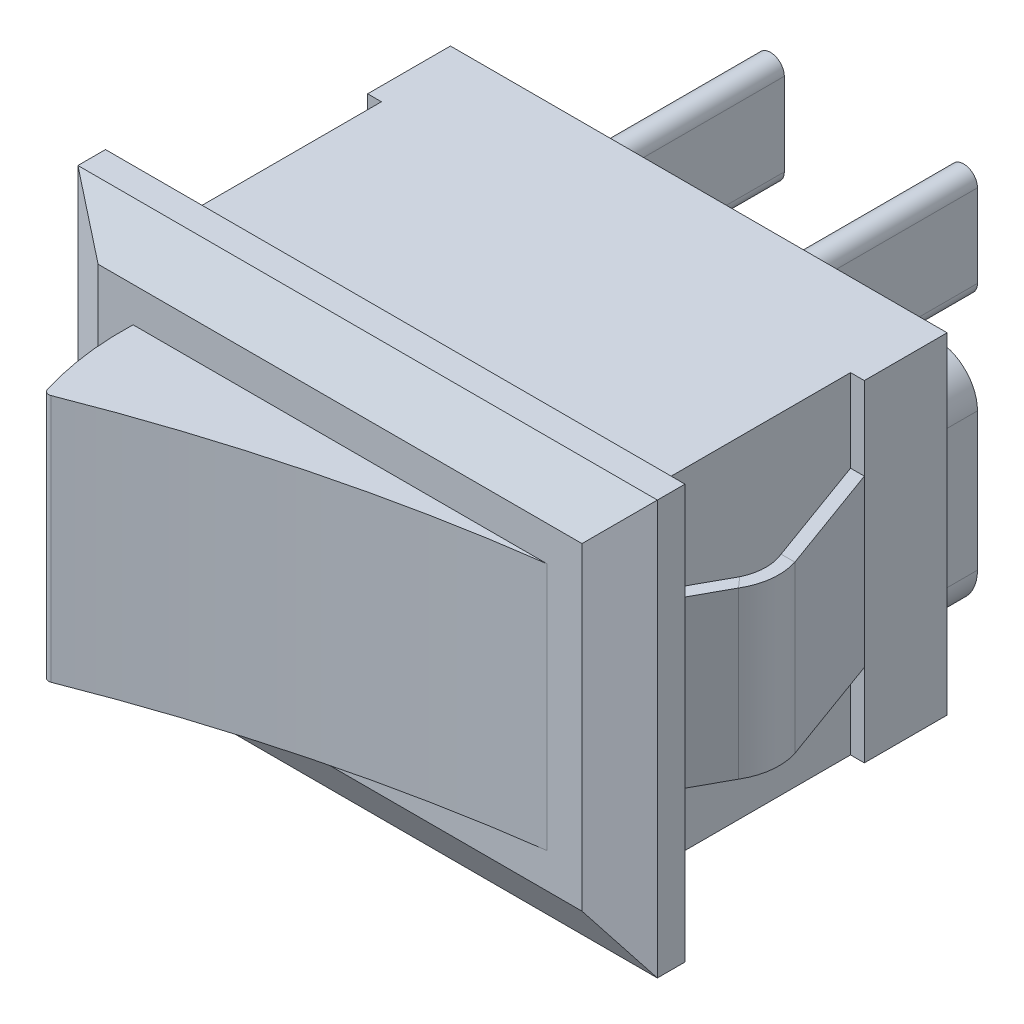
from build123d import *
from OCP.BRepFilletAPI import BRepFilletAPI_MakeChamfer

# Parameters (mm, degrees)
SKETCH_1_W             = 21
SKETCH_1_H             = 15
EXTRUDE_1_DEPTH        = 17
SKETCH_3_OUTSIDE_W     = 29.18
SKETCH_3_OUTSIDE_H     = 23.18
SKETCH_3_OUTSIDE_W_2   = 18
SKETCH_3_OUTSIDE_H_2   = 12
CUT_EXTRUDE_1_DEPTH    = 11
SKETCH_4_OUTSIDE_W     = 29.18
SKETCH_4_OUTSIDE_H     = 23.18
SKETCH_4_OUTSIDE_W_2   = 15
SKETCH_4_OUTSIDE_H_2   = 9
CUT_EXTRUDE_2_DEPTH    = 4
CUT_EXTRUDE_3_REACH    = 31.563
CUT_EXTRUDE_4_REACH    = 31.563
FILLET_2_R             = 0.2
CHAMFER_1_SIZE         = 1
CHAMFER_1_SIZE2        = 1.732050808
CUT_EXTRUDE_5_REACH    = 32.046
SKETCH_7_W             = 3.215432019
SKETCH_7_H             = 8
SKETCH_8_W             = 0.5
SKETCH_8_H             = 6
EXTRUDE_2_DEPTH        = 1.6
EXTRUDE_3_DEPTH        = 8
PATTERN_LINEAR_2_COUNT = 3
PATTERN_LINEAR_2_PITCH = 7
PATTERN_LINEAR_3_COUNT = 2
PATTERN_LINEAR_3_PITCH = 7


with BuildPart() as part:
    # 草图1 → 凸台-拉伸1 (new body)
    with BuildSketch(Plane.XY):
        with Locations((10.5, 7.5)):
            Rectangle(SKETCH_1_W, SKETCH_1_H)
    extrude(amount=EXTRUDE_1_DEPTH)

    # 草图3 outside → 切除-拉伸1 (cut)
    with BuildSketch(Plane(origin=(0, 0, 0), x_dir=(-1, 0, 0), z_dir=(0, 0, -1))):
        with Locations((-10.5, 7.5)):
            Rectangle(SKETCH_3_OUTSIDE_W, SKETCH_3_OUTSIDE_H)
        with Locations((-10.5, 7.5)):
            Rectangle(SKETCH_3_OUTSIDE_W_2, SKETCH_3_OUTSIDE_H_2, mode=Mode.SUBTRACT)
    extrude(amount=-CUT_EXTRUDE_1_DEPTH, mode=Mode.SUBTRACT)

    # 草图4 outside → 切除-拉伸2 (cut)
    with BuildSketch(Plane.XY.offset(17)):
        with Locations((10.5, 7.5)):
            Rectangle(SKETCH_4_OUTSIDE_W, SKETCH_4_OUTSIDE_H)
        with Locations((10.5, 7.5)):
            Rectangle(SKETCH_4_OUTSIDE_W_2, SKETCH_4_OUTSIDE_H_2, mode=Mode.SUBTRACT)
    extrude(amount=-CUT_EXTRUDE_2_DEPTH, mode=Mode.SUBTRACT)

    # 草图5 → 切除-拉伸3 (cut, up to next)
    with BuildSketch(Plane.XZ.offset(-3), mode=Mode.PRIVATE) as cut_extrude_3_sk1:
        with BuildLine():
            Line((3, 17), (3.786081295, 18.926671419))
            Line((3.786081295, 18.926671419), (19.848042348, 18.643435221))
            Line((19.848042348, 18.643435221), (18, 13))
            ThreePointArc((18, 13), (10.37304874, 14.523932773), (3, 17))
        make_face()
    cut_extrude_3_tool1 = extrude(cut_extrude_3_sk1.sketch, amount=-CUT_EXTRUDE_3_REACH, mode=Mode.PRIVATE) & part.part
    add(cut_extrude_3_tool1.solids().sort_by_distance((12.266887, 3, 16.568518))[0], mode=Mode.SUBTRACT)

    # 草图6 → 切除-拉伸4 (cut, up to next)
    with BuildSketch(Plane.XZ.offset(-3), mode=Mode.PRIVATE) as cut_extrude_4_sk1:
        with BuildLine():
            Line((3.538726555, 16.783166359), (1.834472807, 18.259535343))
            Line((1.834472807, 18.259535343), (1.834472807, 13.545763946))
            Line((1.834472807, 13.545763946), (3, 13))
            ThreePointArc((3, 13), (3.102200266, 14.915387354), (3.538726555, 16.783166359))
        make_face()
    cut_extrude_4_tool1 = extrude(cut_extrude_4_sk1.sketch, amount=-CUT_EXTRUDE_4_REACH, mode=Mode.PRIVATE) & part.part
    add(cut_extrude_4_tool1.solids().sort_by_distance((2.498394, 3, 15.595743))[0], mode=Mode.SUBTRACT)

    # 圆角2
    fillet_2_edges = [part.edges().sort_by_distance(p)[0] for p in [
        (3.538726555, 7.5, 16.783166359),
    ]]
    fillet(fillet_2_edges, radius=FILLET_2_R)

    # 倒角1: one chamfer whose edges measure the first distance from different faces: ONE call of the kernel's chamfer builder (chamfer() names one face for all edges)
    chamfer_1_edges_1 = [part.edges().sort_by_distance(p)[0] for p in [
        (10.5, 15, 13),
    ]]
    chamfer_1_side_1 = [part.faces().sort_by_distance(p)[0] for p in [
        (10.5, 15, 12),
    ]]
    chamfer_1_edges_2 = [part.edges().sort_by_distance(p)[0] for p in [
        (0, 7.5, 13),
    ]]
    chamfer_1_side_2 = [part.faces().sort_by_distance(p)[0] for p in [
        (0, 7.5, 12),
    ]]
    chamfer_1_edges_3 = [part.edges().sort_by_distance(p)[0] for p in [
        (10.5, 0, 13),
    ]]
    chamfer_1_side_3 = [part.faces().sort_by_distance(p)[0] for p in [
        (10.5, 0, 12),
    ]]
    chamfer_1_edges_4 = [part.edges().sort_by_distance(p)[0] for p in [
        (21, 7.5, 13),
    ]]
    chamfer_1_side_4 = [part.faces().sort_by_distance(p)[0] for p in [
        (21, 7.5, 12),
    ]]
    chamfer_1 = BRepFilletAPI_MakeChamfer(part.part.solid().wrapped)
    for e in chamfer_1_edges_1:
        chamfer_1.Add(CHAMFER_1_SIZE, CHAMFER_1_SIZE2, e.wrapped, chamfer_1_side_1[0].wrapped)  # the first distance lies on this face
    for e in chamfer_1_edges_2:
        chamfer_1.Add(CHAMFER_1_SIZE, CHAMFER_1_SIZE2, e.wrapped, chamfer_1_side_2[0].wrapped)  # the first distance lies on this face
    for e in chamfer_1_edges_3:
        chamfer_1.Add(CHAMFER_1_SIZE, CHAMFER_1_SIZE2, e.wrapped, chamfer_1_side_3[0].wrapped)  # the first distance lies on this face
    for e in chamfer_1_edges_4:
        chamfer_1.Add(CHAMFER_1_SIZE, CHAMFER_1_SIZE2, e.wrapped, chamfer_1_side_4[0].wrapped)  # the first distance lies on this face
    add(Compound.cast(chamfer_1.Shape()), mode=Mode.REPLACE)

    # 草图7 → 切除-拉伸5 (cut, up to next)
    with BuildSketch(Plane.XZ.offset(-1.5), mode=Mode.PRIVATE) as cut_extrude_5_sk1:
        with Locations((0.39228399, 7)):
            Rectangle(SKETCH_7_W, SKETCH_7_H)
    cut_extrude_5_tool1 = extrude(cut_extrude_5_sk1.sketch, amount=-CUT_EXTRUDE_5_REACH, mode=Mode.PRIVATE) & part.part
    # 草图7 → 切除-拉伸5 (cut, up to next)
    with BuildSketch(Plane.XZ.offset(-1.5), mode=Mode.PRIVATE) as cut_extrude_5_sk2:
        with Locations((20.60771601, 7)):
            Rectangle(SKETCH_7_W, SKETCH_7_H)
    cut_extrude_5_tool2 = extrude(cut_extrude_5_sk2.sketch, amount=-CUT_EXTRUDE_5_REACH, mode=Mode.PRIVATE) & part.part
    add(cut_extrude_5_tool1.solids().sort_by_distance((0.392284, 1.5, 7))[0], mode=Mode.SUBTRACT)
    add(cut_extrude_5_tool2.solids().sort_by_distance((20.607716, 1.5, 7))[0], mode=Mode.SUBTRACT)

    # 扫描1: sweep along a path in 草图9
    with BuildLine(Plane(origin=(0, 7.5, 0), x_dir=(-1, 0, 0), z_dir=(0, -1, 0))) as sweep_1_path:
        Line((-1.75, -3), (-0.309821019, -6.95685923))
        ThreePointArc((-0.309821019, -6.95685923), (-0.195012991, -7.793192673), (-0.4354877, -8.602393776))
        Line((-0.4354877, -8.602393776), (-1.75, -11))
    # 草图8 → 扫描1 (sweep)
    with BuildSketch(Plane.XY.offset(3)):
        with Locations((1.75, 7.5)):
            Rectangle(SKETCH_8_W, SKETCH_8_H)
    sweep_1 = sweep(path=sweep_1_path.line)

    # 镜向1: 扫描1 across plane
    add(sweep_1.mirror(Plane(origin=(10.5, 0, 0), x_dir=(0, 0, 1), z_dir=(1, 0, 0))))

    # 草图10 → 凸台-拉伸2 (add)
    with BuildSketch(Plane(origin=(0, 0, 0), x_dir=(-1, 0, 0), z_dir=(0, 0, -1))):
        with BuildLine():
            Line((-5, 5), (-5, 10))
            ThreePointArc((-5, 10), (-3.5, 11.5), (-2, 10))
            Line((-2, 10), (-2, 5))
            ThreePointArc((-2, 5), (-3.5, 3.5), (-5, 5))
        make_face()
    extrude_2 = extrude(amount=EXTRUDE_2_DEPTH)

    # 草图11 → 凸台-拉伸3 (add)
    with BuildSketch(Plane(origin=(0, 0, -1.6), x_dir=(-1, 0, 0), z_dir=(0, 0, -1))):
        with BuildLine():
            Line((-4, 6), (-4, 9))
            ThreePointArc((-4, 9), (-3.5, 9.5), (-3, 9))
            Line((-3, 9), (-3, 6))
            ThreePointArc((-3, 6), (-3.5, 5.5), (-4, 6))
        make_face()
    extrude_3 = extrude(amount=EXTRUDE_3_DEPTH)

    # 阵列(线性)2: 凸台-拉伸2 ×3
    with Locations(*[(i * PATTERN_LINEAR_2_PITCH, 0, 0) for i in range(1, PATTERN_LINEAR_2_COUNT)]):
        add(extrude_2)

    # 阵列(线性)3: 凸台-拉伸3 ×2
    with Locations(*[(i * PATTERN_LINEAR_3_PITCH, 0, 0) for i in range(1, PATTERN_LINEAR_3_COUNT)]):
        add(extrude_3)


solid = part.part
